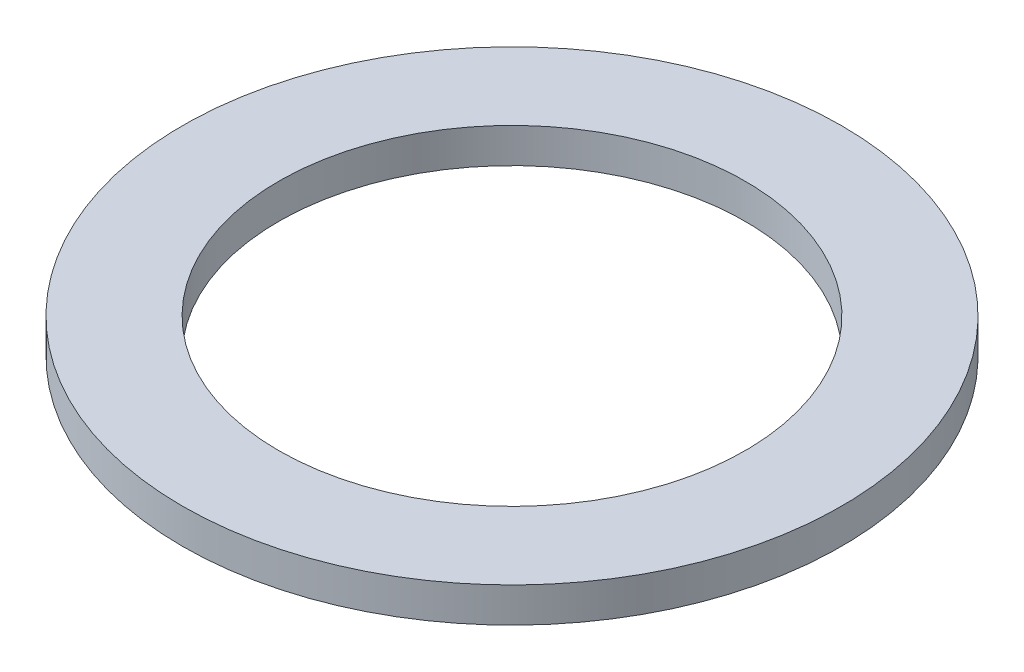
from build123d import *

# Parameters (mm, degrees)
SKETCH1_R           = 22
SKETCH1_R_2         = 15.575
BOSS_EXTRUDE1_DEPTH = 2.325


with BuildPart() as part:
    # Sketch1 → Boss-Extrude1 (new body)
    with BuildSketch(Plane(origin=(0, 0, 0), x_dir=(1, 0, 0), z_dir=(0, 1, 0))):
        with Locations(Location((0, 0, 0), (0, 0, 270))):
            Circle(SKETCH1_R)
        with Locations(Location((0, 0, 0), (0, 0, 270))):
            Circle(SKETCH1_R_2, mode=Mode.SUBTRACT)
    extrude(amount=-BOSS_EXTRUDE1_DEPTH)


solid = part.part
